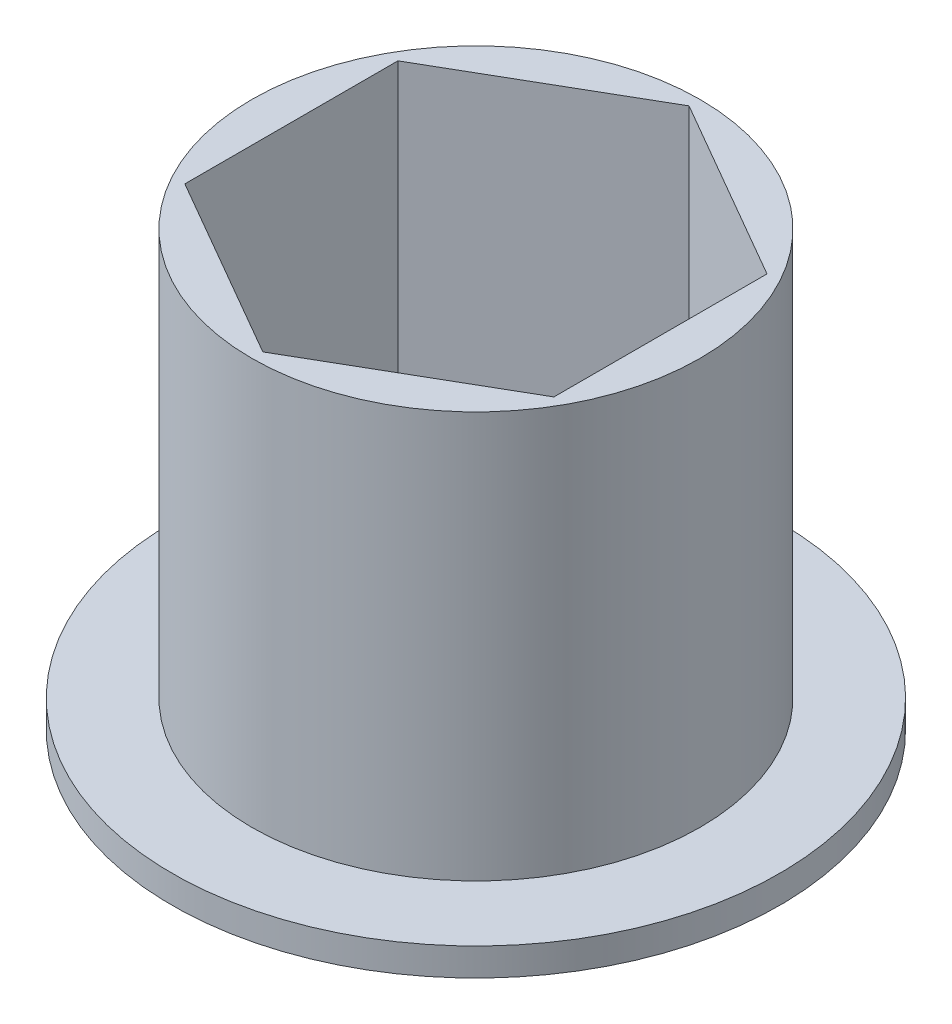
from build123d import *

# Parameters (mm, degrees)
SKETCH1_R           = 6.15
BOSS_EXTRUDE1_DEPTH = 11.90625
SKETCH1_3_R         = 8.334375
SKETCH1_3_R_2       = 6.15
BOSS_EXTRUDE2_DEPTH = 0.762


with BuildPart() as part:
    # Sketch1 → Boss-Extrude1 (new body)
    with BuildSketch(Plane(origin=(0, 0, 0), x_dir=(1, 0, 0), z_dir=(0, 1, 0))):
        Circle(SKETCH1_R)
        Polygon((-5.0625, 2.922835738), (0, 5.845671476), (5.0625, 2.922835738), (5.0625, -2.922835738), (0, -5.845671476), (-5.0625, -2.922835738), align=None, mode=Mode.SUBTRACT)
    extrude(amount=BOSS_EXTRUDE1_DEPTH)

    # Sketch1<3> → Boss-Extrude2 (add)
    with BuildSketch(Plane(origin=(0, 0, 0), x_dir=(1, 0, 0), z_dir=(0, 1, 0))):
        Circle(SKETCH1_3_R)
        Circle(SKETCH1_3_R_2, mode=Mode.SUBTRACT)
    extrude(amount=BOSS_EXTRUDE2_DEPTH)


solid = part.part
